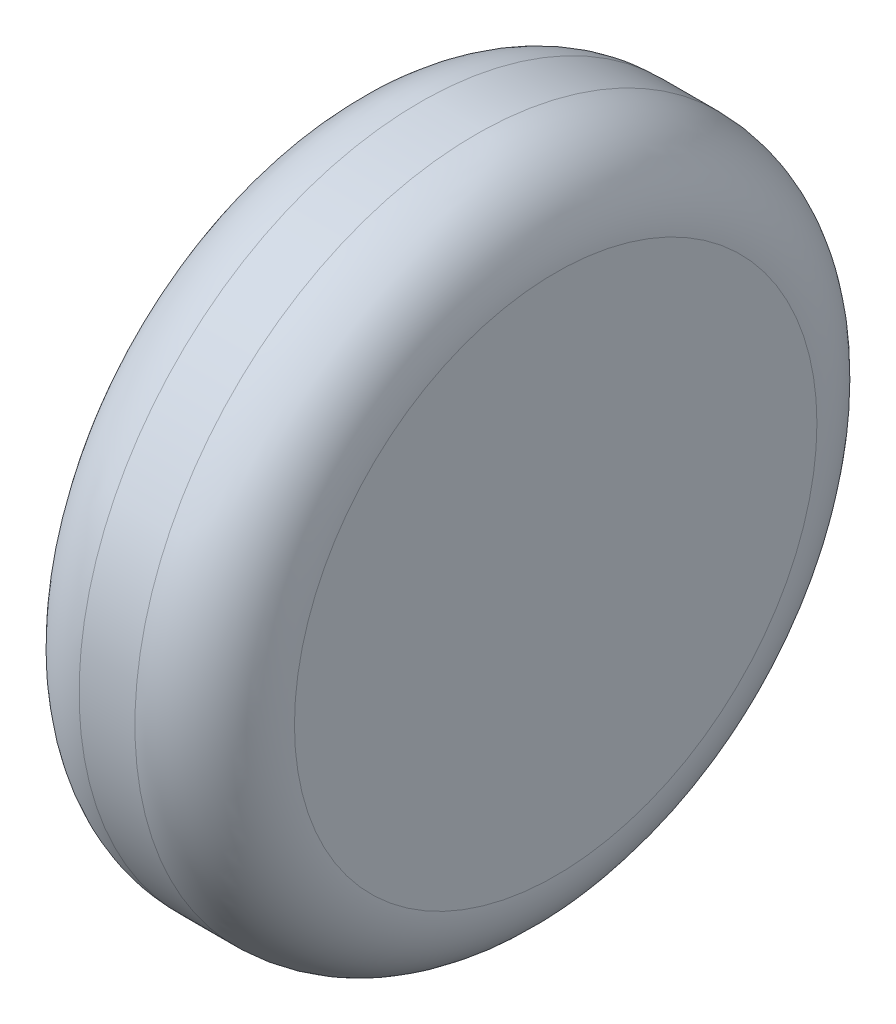
from build123d import *

# Parameters (mm, degrees)
SKETCH1_R           = 38
BOSS_EXTRUDE1_DEPTH = 24
FILLET1_R           = 8.89
SKETCH4_R           = 10.922
BOSS_EXTRUDE2_DEPTH = 3.302
CUT_EXTRUDE3_DEPTH  = 17.526


with BuildPart() as part:
    # Sketch1 → Boss-Extrude1 (new body)
    with BuildSketch(Plane(origin=(0, 0, 0), x_dir=(0, 0, -1), z_dir=(1, 0, 0))):
        Circle(SKETCH1_R)
    extrude(amount=BOSS_EXTRUDE1_DEPTH)

    # Fillet1
    fillet1_edges = [part.edges().sort_by_distance(p)[0] for p in [
        (0, 0, 38),
        (24, 0, 38),
    ]]
    fillet(fillet1_edges, radius=FILLET1_R)

    # Sketch4 → Boss-Extrude2 (add)
    with BuildSketch(Plane.ZY):
        with Locations(Location((0, 0, 0), (0, 0, 180))):
            Circle(SKETCH4_R)
    extrude(amount=BOSS_EXTRUDE2_DEPTH)

    # Sketch5 → Cut-Extrude3 (cut)
    with BuildSketch(Plane.ZY.offset(3.302)):
        with BuildLine():
            Line((-1.658312395, 2.5), (1.658312395, 2.5))
            ThreePointArc((1.658312395, 2.5), (0, -3), (-1.658312395, 2.5))
        make_face()
    extrude(amount=-CUT_EXTRUDE3_DEPTH, mode=Mode.SUBTRACT)


solid = part.part
